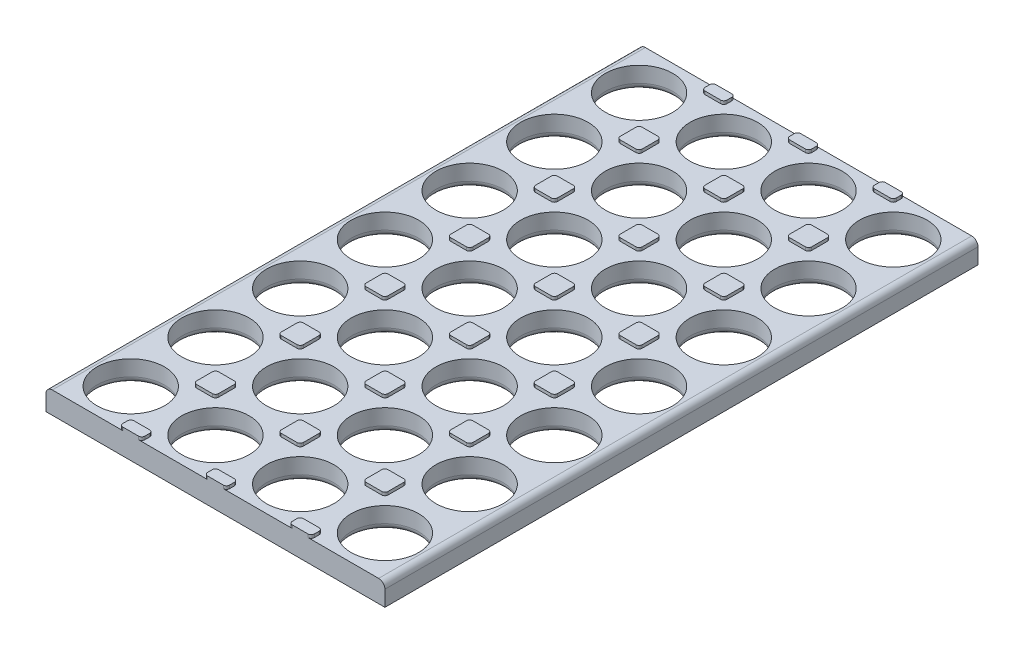
from build123d import *

# Parameters (mm, degrees)
SKETCH1_W            = 108
SKETCH1_H            = 189
SKETCH1_R            = 10.75
MAIN_BODY_DEPTH      = 7
SKETCH2_W            = 7
SKETCH2_H            = 3.5
SKETCH2_H_2          = 7
BOTTOM_STOPPER_DEPTH = 1
FILLET1_R            = 1
FILLET2_R            = 2


with BuildPart() as part:
    # Sketch1 → main-body (new body)
    with BuildSketch(Plane(origin=(0, 0, 0), x_dir=(1, 0, 0), z_dir=(0, 1, 0))):
        with Locations((54, 94.5)):
            Rectangle(SKETCH1_W, SKETCH1_H)
        with Locations(Location((13.5, 13.5, 0), (0, 0, 270))):
            Circle(SKETCH1_R, mode=Mode.SUBTRACT)
        with Locations(Location((40.5, 13.5, 0), (0, 0, 270))):
            Circle(SKETCH1_R, mode=Mode.SUBTRACT)
        with Locations(Location((67.5, 13.5, 0), (0, 0, 270))):
            Circle(SKETCH1_R, mode=Mode.SUBTRACT)
        with Locations(Location((94.5, 13.5, 0), (0, 0, 270))):
            Circle(SKETCH1_R, mode=Mode.SUBTRACT)
        with Locations(Location((40.5, 40.5, 0), (0, 0, 270))):
            Circle(SKETCH1_R, mode=Mode.SUBTRACT)
        with Locations(Location((67.5, 40.5, 0), (0, 0, 270))):
            Circle(SKETCH1_R, mode=Mode.SUBTRACT)
        with Locations(Location((94.5, 40.5, 0), (0, 0, 270))):
            Circle(SKETCH1_R, mode=Mode.SUBTRACT)
        with Locations(Location((40.5, 67.5, 0), (0, 0, 270))):
            Circle(SKETCH1_R, mode=Mode.SUBTRACT)
        with Locations(Location((67.5, 67.5, 0), (0, 0, 270))):
            Circle(SKETCH1_R, mode=Mode.SUBTRACT)
        with Locations(Location((94.5, 67.5, 0), (0, 0, 270))):
            Circle(SKETCH1_R, mode=Mode.SUBTRACT)
        with Locations(Location((40.5, 94.5, 0), (0, 0, 270))):
            Circle(SKETCH1_R, mode=Mode.SUBTRACT)
        with Locations(Location((67.5, 94.5, 0), (0, 0, 270))):
            Circle(SKETCH1_R, mode=Mode.SUBTRACT)
        with Locations(Location((94.5, 94.5, 0), (0, 0, 270))):
            Circle(SKETCH1_R, mode=Mode.SUBTRACT)
        with Locations(Location((40.5, 121.5, 0), (0, 0, 270))):
            Circle(SKETCH1_R, mode=Mode.SUBTRACT)
        with Locations(Location((67.5, 121.5, 0), (0, 0, 270))):
            Circle(SKETCH1_R, mode=Mode.SUBTRACT)
        with Locations(Location((94.5, 121.5, 0), (0, 0, 270))):
            Circle(SKETCH1_R, mode=Mode.SUBTRACT)
        with Locations(Location((40.5, 148.5, 0), (0, 0, 270))):
            Circle(SKETCH1_R, mode=Mode.SUBTRACT)
        with Locations(Location((67.5, 148.5, 0), (0, 0, 270))):
            Circle(SKETCH1_R, mode=Mode.SUBTRACT)
        with Locations(Location((94.5, 148.5, 0), (0, 0, 270))):
            Circle(SKETCH1_R, mode=Mode.SUBTRACT)
        with Locations(Location((40.5, 175.5, 0), (0, 0, 270))):
            Circle(SKETCH1_R, mode=Mode.SUBTRACT)
        with Locations(Location((67.5, 175.5, 0), (0, 0, 270))):
            Circle(SKETCH1_R, mode=Mode.SUBTRACT)
        with Locations(Location((94.5, 175.5, 0), (0, 0, 270))):
            Circle(SKETCH1_R, mode=Mode.SUBTRACT)
        with Locations(Location((13.5, 40.5, 0), (0, 0, 270))):
            Circle(SKETCH1_R, mode=Mode.SUBTRACT)
        with Locations(Location((13.5, 67.5, 0), (0, 0, 270))):
            Circle(SKETCH1_R, mode=Mode.SUBTRACT)
        with Locations(Location((13.5, 94.5, 0), (0, 0, 270))):
            Circle(SKETCH1_R, mode=Mode.SUBTRACT)
        with Locations(Location((13.5, 121.5, 0), (0, 0, 270))):
            Circle(SKETCH1_R, mode=Mode.SUBTRACT)
        with Locations(Location((13.5, 148.5, 0), (0, 0, 270))):
            Circle(SKETCH1_R, mode=Mode.SUBTRACT)
        with Locations(Location((13.5, 175.5, 0), (0, 0, 270))):
            Circle(SKETCH1_R, mode=Mode.SUBTRACT)
    extrude(amount=MAIN_BODY_DEPTH)

    # Sketch2 → bottom-stopper (add)
    with BuildSketch(Plane(origin=(0, 7, 0), x_dir=(1, 0, 0), z_dir=(0, 1, 0))):
        with Locations((27, 1.75)):
            Rectangle(SKETCH2_W, SKETCH2_H)
        with Locations((54, 1.75)):
            Rectangle(SKETCH2_W, SKETCH2_H)
        with Locations((81, 1.75)):
            Rectangle(SKETCH2_W, SKETCH2_H)
        with Locations((81, 27)):
            Rectangle(SKETCH2_W, SKETCH2_H_2)
        with Locations((54, 27)):
            Rectangle(SKETCH2_W, SKETCH2_H_2)
        with Locations((27, 27)):
            Rectangle(SKETCH2_W, SKETCH2_H_2)
        with Locations((27, 54)):
            Rectangle(SKETCH2_W, SKETCH2_H_2)
        with Locations((54, 54)):
            Rectangle(SKETCH2_W, SKETCH2_H_2)
        with Locations((81, 54)):
            Rectangle(SKETCH2_W, SKETCH2_H_2)
        with Locations((81, 81)):
            Rectangle(SKETCH2_W, SKETCH2_H_2)
        with Locations((54, 81)):
            Rectangle(SKETCH2_W, SKETCH2_H_2)
        with Locations((27, 108)):
            Rectangle(SKETCH2_W, SKETCH2_H_2)
        with Locations((54, 108)):
            Rectangle(SKETCH2_W, SKETCH2_H_2)
        with Locations((81, 108)):
            Rectangle(SKETCH2_W, SKETCH2_H_2)
        with Locations((81, 135)):
            Rectangle(SKETCH2_W, SKETCH2_H_2)
        with Locations((54, 135)):
            Rectangle(SKETCH2_W, SKETCH2_H_2)
        with Locations((27, 135)):
            Rectangle(SKETCH2_W, SKETCH2_H_2)
        with Locations((27, 162)):
            Rectangle(SKETCH2_W, SKETCH2_H_2)
        with Locations((54, 162)):
            Rectangle(SKETCH2_W, SKETCH2_H_2)
        with Locations((81, 162)):
            Rectangle(SKETCH2_W, SKETCH2_H_2)
        with Locations((81, 187.25)):
            Rectangle(SKETCH2_W, SKETCH2_H)
        with Locations((54, 187.25)):
            Rectangle(SKETCH2_W, SKETCH2_H)
        with Locations((27, 187.25)):
            Rectangle(SKETCH2_W, SKETCH2_H)
        with Locations((27, 81)):
            Rectangle(SKETCH2_W, SKETCH2_H_2)
    extrude(amount=BOTTOM_STOPPER_DEPTH)

    # Fillet1
    fillet1_edges = [part.edges().sort_by_distance(p)[0] for p in [
        (84.5, 7.5, -57.5),
        (77.5, 7.5, -57.5),
        (77.5, 7.5, -50.5),
        (84.5, 7.5, -50.5),
        (57.5, 7.5, -57.5),
        (50.5, 7.5, -57.5),
        (50.5, 7.5, -50.5),
        (57.5, 7.5, -50.5),
        (30.5, 7.5, -57.5),
        (23.5, 7.5, -57.5),
        (23.5, 7.5, -50.5),
        (30.5, 7.5, -50.5),
        (30.5, 7.5, -30.5),
        (23.5, 7.5, -30.5),
        (23.5, 7.5, -23.5),
        (30.5, 7.5, -23.5),
        (57.5, 7.5, -30.5),
        (50.5, 7.5, -30.5),
        (50.5, 7.5, -23.5),
        (57.5, 7.5, -23.5),
        (84.5, 7.5, -30.5),
        (77.5, 7.5, -30.5),
        (77.5, 7.5, -23.5),
        (84.5, 7.5, -23.5),
        (84.5, 7.5, -3.5),
        (77.5, 7.5, -3.5),
        (77.5, 7.5, 0),
        (84.5, 7.5, 0),
        (57.5, 7.5, -3.5),
        (50.5, 7.5, -3.5),
        (50.5, 7.5, 0),
        (57.5, 7.5, 0),
        (30.5, 7.5, -138.5),
        (23.5, 7.5, -138.5),
        (23.5, 7.5, -131.5),
        (30.5, 7.5, -131.5),
        (57.5, 7.5, -138.5),
        (50.5, 7.5, -138.5),
        (50.5, 7.5, -131.5),
        (57.5, 7.5, -131.5),
        (84.5, 7.5, -138.5),
        (77.5, 7.5, -138.5),
        (77.5, 7.5, -131.5),
        (84.5, 7.5, -131.5),
        (84.5, 7.5, -111.5),
        (77.5, 7.5, -111.5),
        (77.5, 7.5, -104.5),
        (84.5, 7.5, -104.5),
        (57.5, 7.5, -111.5),
        (50.5, 7.5, -111.5),
        (50.5, 7.5, -104.5),
        (57.5, 7.5, -104.5),
        (30.5, 7.5, -111.5),
        (23.5, 7.5, -111.5),
        (23.5, 7.5, -104.5),
        (30.5, 7.5, -104.5),
        (57.5, 7.5, -84.5),
        (50.5, 7.5, -84.5),
        (50.5, 7.5, -77.5),
        (57.5, 7.5, -77.5),
        (84.5, 7.5, -84.5),
        (77.5, 7.5, -84.5),
        (77.5, 7.5, -77.5),
        (84.5, 7.5, -77.5),
        (23.5, 7.5, -77.5),
        (30.5, 7.5, -77.5),
        (30.5, 7.5, -84.5),
        (23.5, 7.5, -84.5),
        (23.5, 7.5, -185.5),
        (30.5, 7.5, -185.5),
        (30.5, 7.5, -189),
        (23.5, 7.5, -189),
        (50.5, 7.5, -185.5),
        (57.5, 7.5, -185.5),
        (57.5, 7.5, -189),
        (50.5, 7.5, -189),
        (77.5, 7.5, -185.5),
        (84.5, 7.5, -185.5),
        (84.5, 7.5, -189),
        (77.5, 7.5, -189),
        (84.5, 7.5, -165.5),
        (77.5, 7.5, -165.5),
        (77.5, 7.5, -158.5),
        (84.5, 7.5, -158.5),
        (57.5, 7.5, -165.5),
        (50.5, 7.5, -165.5),
        (50.5, 7.5, -158.5),
        (57.5, 7.5, -158.5),
        (30.5, 7.5, -165.5),
        (23.5, 7.5, -165.5),
        (23.5, 7.5, -158.5),
        (30.5, 7.5, -158.5),
        (23.5, 7.5, 0),
        (30.5, 7.5, 0),
        (30.5, 7.5, -3.5),
        (23.5, 7.5, -3.5),
    ]]
    fillet(fillet1_edges, radius=FILLET1_R)

    # Fillet2
    fillet2_edges = [part.edges().sort_by_distance(p)[0] for p in [
        (13.5, 0, -105.25),
        (13.5, 0, -132.25),
        (13.5, 0, -159.25),
        (13.5, 0, -186.25),
        (13.5, 0, -24.25),
        (108, 7, -94.5),
        (40.5, 0, -24.25),
        (67.5, 0, -24.25),
        (94.5, 0, -24.25),
        (40.5, 0, -51.25),
        (67.5, 0, -51.25),
        (94.5, 0, -51.25),
        (40.5, 0, -78.25),
        (67.5, 0, -78.25),
        (94.5, 0, -78.25),
        (0, 7, -94.5),
        (40.5, 0, -105.25),
        (67.5, 0, -105.25),
        (94.5, 0, -105.25),
        (40.5, 0, -132.25),
        (67.5, 0, -132.25),
        (94.5, 0, -132.25),
        (40.5, 0, -159.25),
        (67.5, 0, -159.25),
        (94.5, 0, -159.25),
        (40.5, 0, -186.25),
        (67.5, 0, -186.25),
        (94.5, 0, -186.25),
        (13.5, 0, -51.25),
        (13.5, 0, -78.25),
    ]]
    fillet(fillet2_edges, radius=FILLET2_R)


solid = part.part
